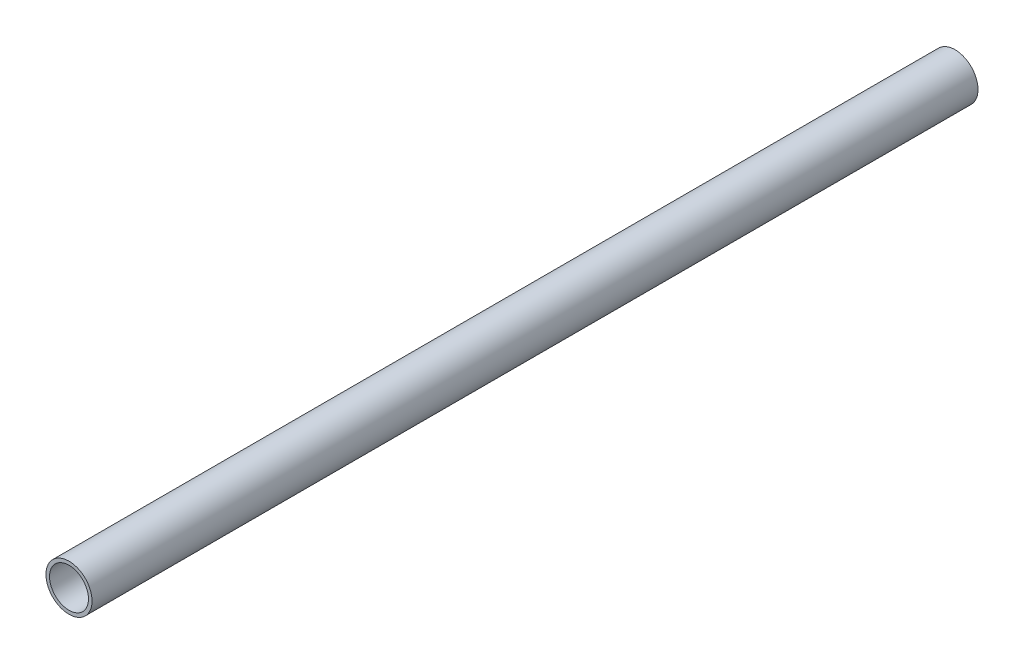
from build123d import *

# Parameters (mm, degrees)
ESQUISSE1_R        = 13
ESQUISSE1_R_2      = 11
BOSS_EXTRU_1_DEPTH = 500


with BuildPart() as part:
    # Esquisse1 → Boss.-Extru.1 (new body)
    with BuildSketch(Plane.XY):
        Circle(ESQUISSE1_R)
        Circle(ESQUISSE1_R_2, mode=Mode.SUBTRACT)
    extrude(amount=BOSS_EXTRU_1_DEPTH)


solid = part.part
